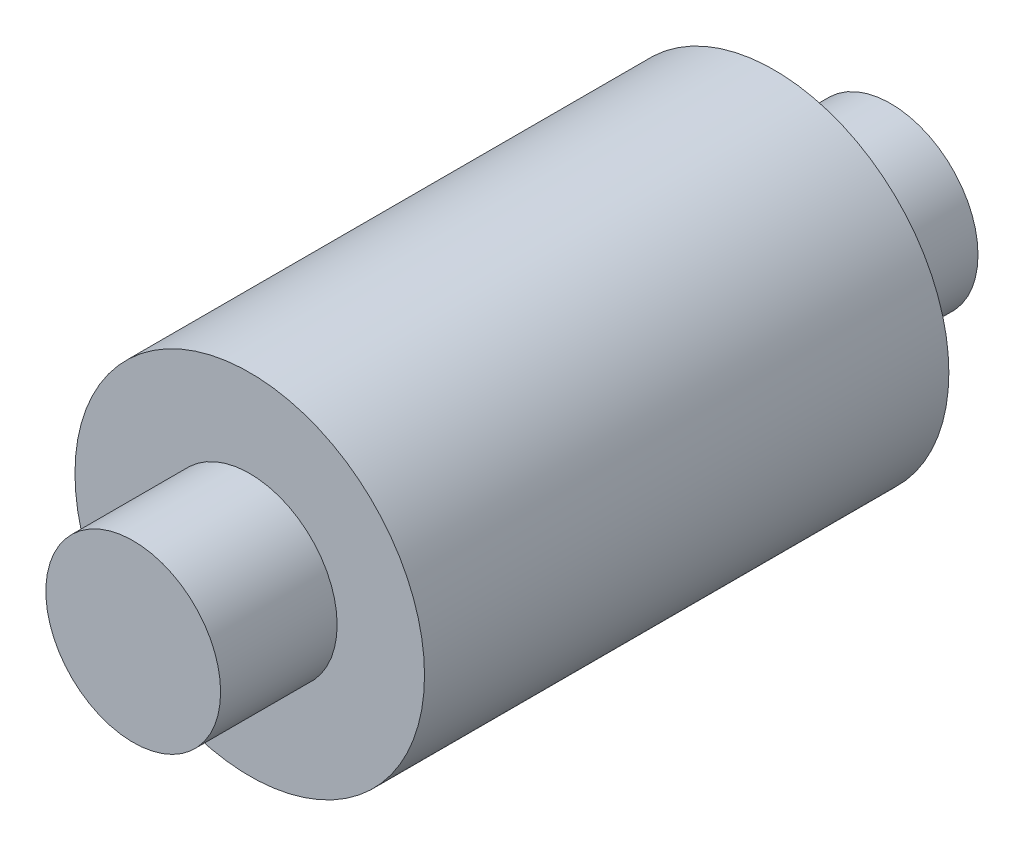
from build123d import *


with BuildPart() as part:
    # Croquis1 → Revolución1 (revolve)
    with BuildSketch(Plane(origin=(0, 0, 0), x_dir=(0, 0, -1), z_dir=(1, 0, 0)), mode=Mode.PRIVATE) as revoluci_n1_sk:
        Polygon((0, 0), (6.5, 0), (6.5, 0.75), (5.5, 0.75), (5.5, 1.5), (1, 1.5), (1, 0.75), (0, 0.75), align=None)
    revolve(revoluci_n1_sk.sketch.rotate(Axis((0, 0, 0), (0, 0, -1)), 90), axis=Axis((0, 0, 0), (0, 0, -1)))


solid = part.part
